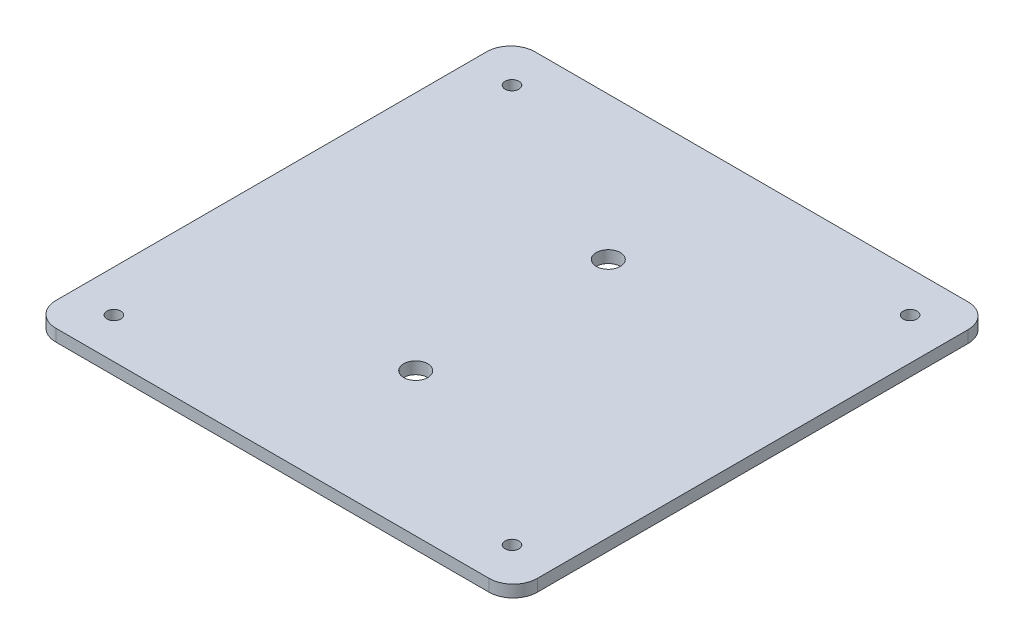
from build123d import *

# Parameters (mm, degrees)
SKETCH1_W           = 127
SKETCH1_H           = 126.359631958
SKETCH1_R           = 1.8288
SKETCH1_R_2         = 3.175
BOSS_EXTRUDE1_DEPTH = 3.175
FILLET1_R           = 6.35


with BuildPart() as part:
    # Sketch1 → Boss-Extrude1 (new body)
    with BuildSketch(Plane(origin=(0, 0, 0), x_dir=(1, 0, 0), z_dir=(0, 1, 0))):
        Rectangle(SKETCH1_W, SKETCH1_H)
        with Locations(Location((-52.5145, 52.5145, 0), (0, 0, 270))):
            Circle(SKETCH1_R, mode=Mode.SUBTRACT)
        with Locations(Location((52.5145, 52.5145, 0), (0, 0, 270))):
            Circle(SKETCH1_R, mode=Mode.SUBTRACT)
        with Locations(Location((52.5145, -52.5145, 0), (0, 0, 270))):
            Circle(SKETCH1_R, mode=Mode.SUBTRACT)
        with Locations(Location((-52.5145, -52.5145, 0), (0, 0, 270))):
            Circle(SKETCH1_R, mode=Mode.SUBTRACT)
        with Locations(Location((0, 25.4, 0), (0, 0, 270))):
            Circle(SKETCH1_R_2, mode=Mode.SUBTRACT)
        with Locations(Location((0, -25.4, 0), (0, 0, 270))):
            Circle(SKETCH1_R_2, mode=Mode.SUBTRACT)
    extrude(amount=BOSS_EXTRUDE1_DEPTH)

    # Fillet1
    fillet1_edges = [part.edges().sort_by_distance(p)[0] for p in [
        (63.5, 1.5875, 63.179815979),
        (-63.5, 1.5875, 63.179815979),
        (-63.5, 1.5875, -63.179815979),
        (63.5, 1.5875, -63.179815979),
    ]]
    fillet(fillet1_edges, radius=FILLET1_R)


solid = part.part
